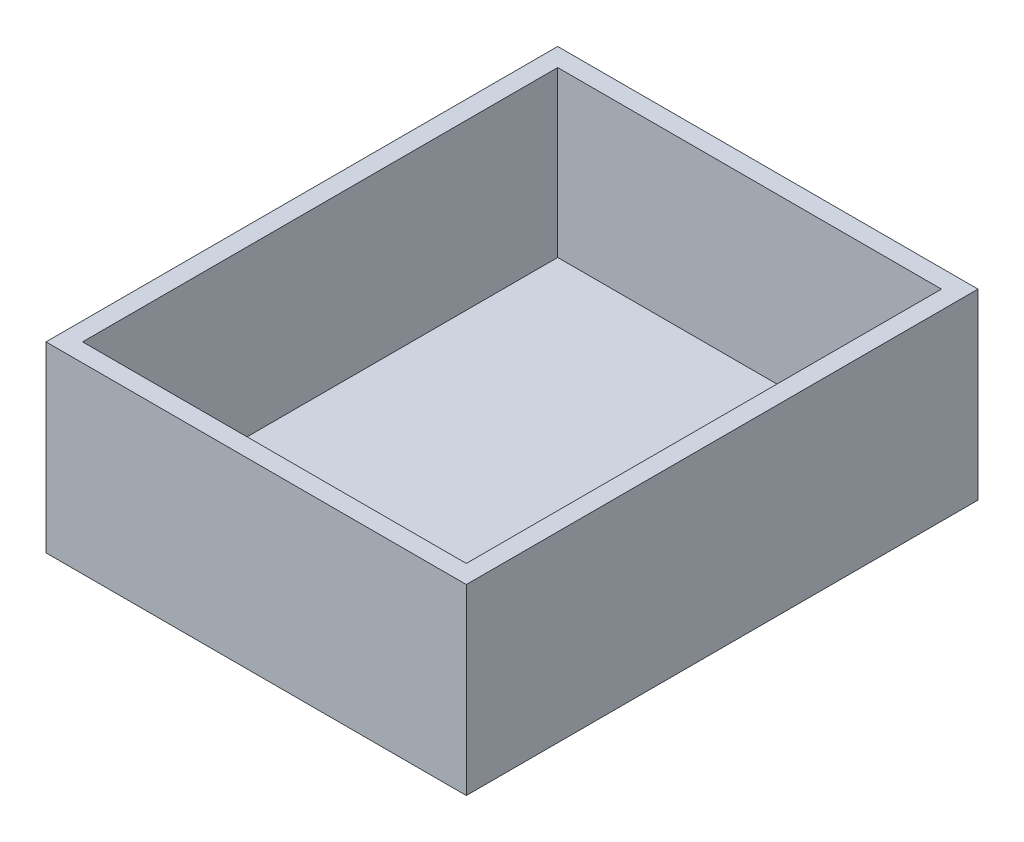
from build123d import *

# Parameters (mm, degrees)
SKETCH1_W           = 115
SKETCH1_H           = 140
BOSS_EXTRUDE1_DEPTH = 50
SKETCH2_W           = 104.989652944
SKETCH2_H           = 130
CUT_EXTRUDE1_DEPTH  = 45


with BuildPart() as part:
    # Sketch1 → Boss-Extrude1 (new body)
    with BuildSketch(Plane(origin=(0, 0, 0), x_dir=(1, 0, 0), z_dir=(0, 1, 0))):
        Rectangle(SKETCH1_W, SKETCH1_H)
    extrude(amount=BOSS_EXTRUDE1_DEPTH)

    # Sketch2 → Cut-Extrude1 (cut)
    with BuildSketch(Plane(origin=(0, 50, 0), x_dir=(1, 0, 0), z_dir=(0, 1, 0))):
        Rectangle(SKETCH2_W, SKETCH2_H)
    extrude(amount=-CUT_EXTRUDE1_DEPTH, mode=Mode.SUBTRACT)


solid = part.part
